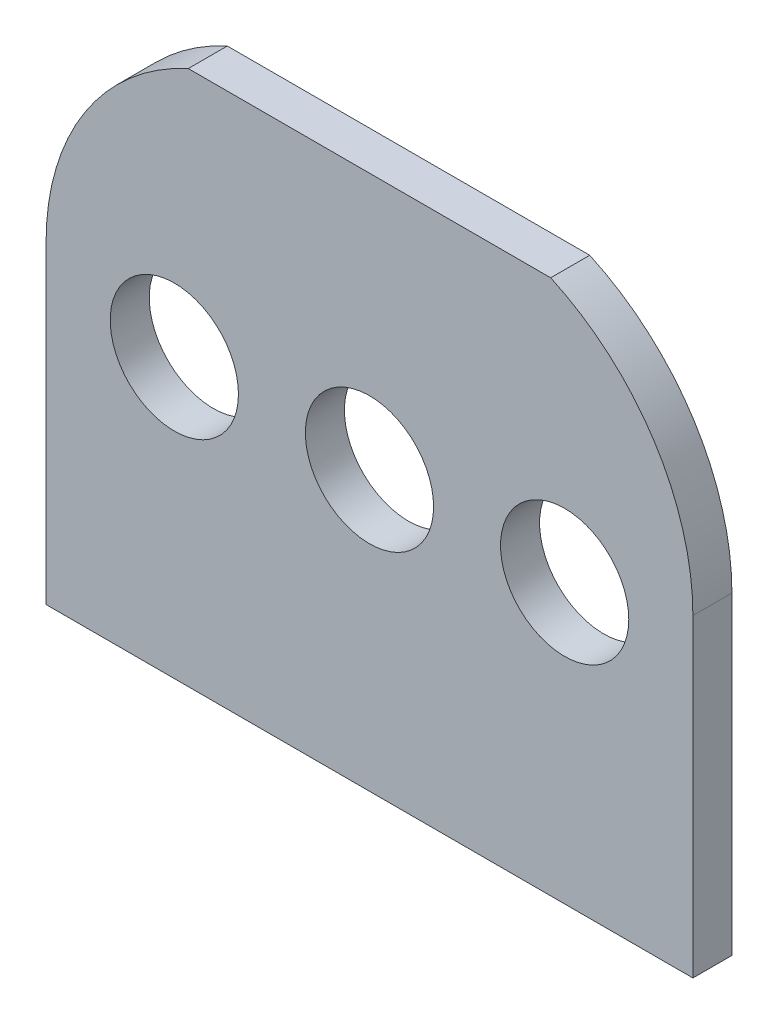
from build123d import *

# Parameters (mm, degrees)
SZKIC1_R                    = 1.15
DODANIE_WYCI_GNI_CIE1_DEPTH = 0.7


with BuildPart() as part:
    # Szkic1 → Dodanie-wyciągnięcie1 (new body)
    with BuildSketch(Plane.XY):
        with BuildLine():
            Line((-5.8, -4.994143627), (5.8, -4.994143627))
            Line((5.8, -4.994143627), (5.8, 0.63488027))
            ThreePointArc((5.8, 0.63488027), (5.10760912, 2.994496299), (3.25, 4.605856373))
            Line((3.25, 4.605856373), (-3.25, 4.605856373))
            ThreePointArc((-3.25, 4.605856373), (-5.10760912, 2.994496299), (-5.8, 0.63488027))
            Line((-5.8, 0.63488027), (-5.8, -4.994143627))
        make_face()
        Circle(SZKIC1_R, mode=Mode.SUBTRACT)
        with Locations((3.5, 0)):
            Circle(SZKIC1_R, mode=Mode.SUBTRACT)
        with Locations((-3.5, 0)):
            Circle(SZKIC1_R, mode=Mode.SUBTRACT)
    extrude(amount=DODANIE_WYCI_GNI_CIE1_DEPTH)


solid = part.part
